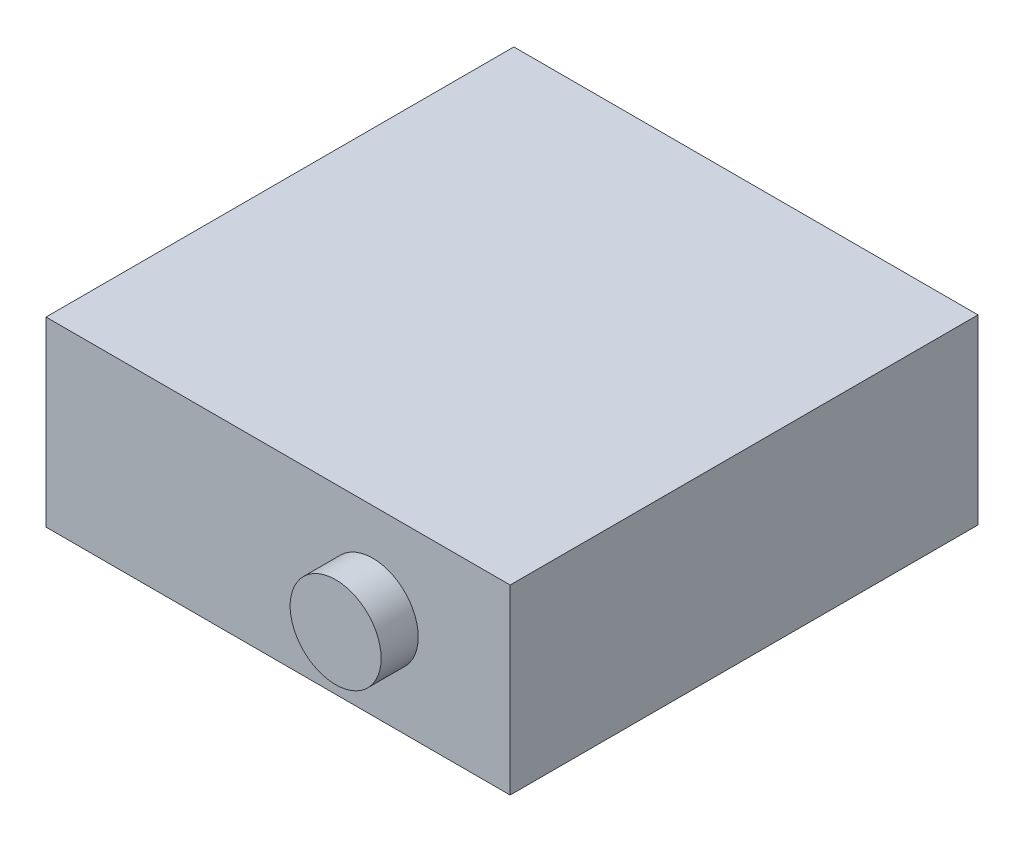
from build123d import *

# Parameters (mm, degrees)
SKETCH1_W           = 31.75
SKETCH1_H           = 12.446
BOSS_EXTRUDE1_DEPTH = 32.004
SKETCH2_R           = 3.1115
BOSS_EXTRUDE2_DEPTH = 2.54


with BuildPart() as part:
    # Sketch1 → Boss-Extrude1 (new body)
    with BuildSketch(Plane.XY):
        with Locations((15.875, -6.223)):
            Rectangle(SKETCH1_W, SKETCH1_H)
    extrude(amount=BOSS_EXTRUDE1_DEPTH)

    # Sketch2 → Boss-Extrude2 (add)
    with BuildSketch(Plane.XY.offset(32.004)):
        with Locations((22.352, -6.223)):
            Circle(SKETCH2_R)
    extrude(amount=BOSS_EXTRUDE2_DEPTH)


solid = part.part
